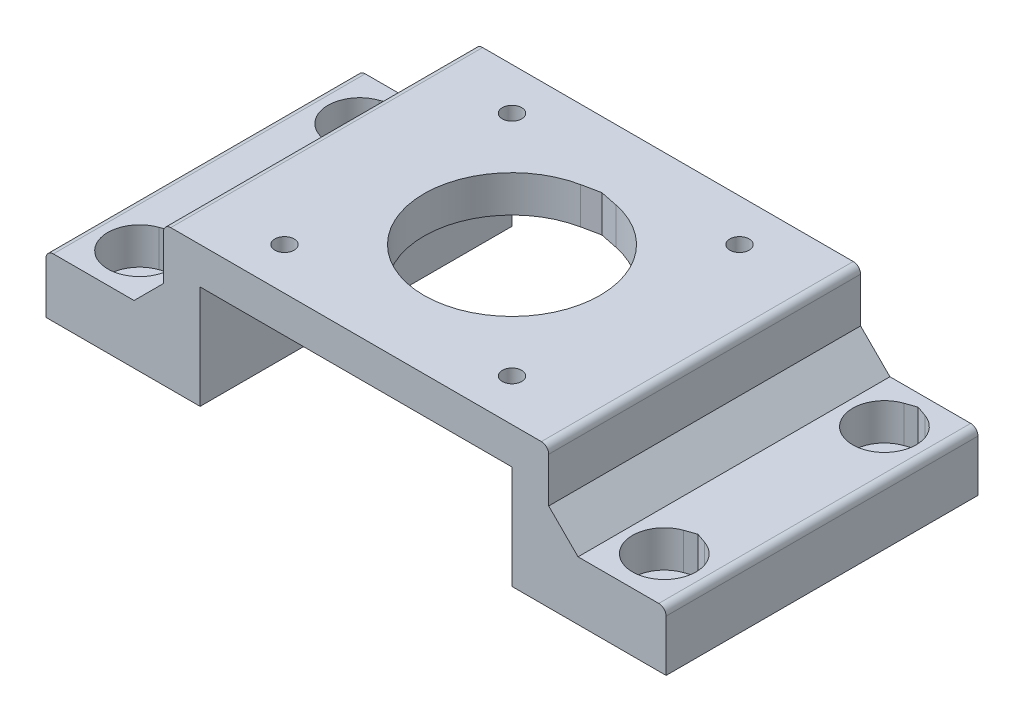
from build123d import *

# Parameters (mm, degrees)
ESQUISSE1_W                  = 42.5
ESQUISSE1_H                  = 42.5
BOSS_EXTRU_1_DEPTH           = 5
ESQUISSE2_R                  = 1.325
ENL_V_MAT_EXTRU_1_DEPTH      = 31.465144017
ENL_V_MAT_EXTRU_2_DEPTH      = 31.465144017
ESQUISSE4_W                  = 42.5
ESQUISSE4_H                  = 19.1
BOSS_EXTRU_2_DEPTH           = 5
ESQUISSE5_W                  = 42.5
ESQUISSE5_H                  = 8
BOSS_EXTRU_3_DEPTH           = 16
ESQUISSE7_R                  = 2.6
ENL_V_MAT_EXTRU_3_DEPTH      = 49.578132941
CONG_2_R                     = 1
CHANFREIN1_SIZE              = 4
CONG_2_OF_SYM_TRIE3_R        = 1
CHANFREIN1_OF_SYM_TRIE3_SIZE = 4
ESQUISSE11_R                 = 4.325
ENL_V_MAT_EXTRU_4_DEPTH      = 5
ENL_V_MAT_EXTRU_5_DEPTH      = 5
ENL_V_MAT_EXTRU_6_DEPTH      = 50.958332638
ENL_V_MAT_EXTRU_7_DEPTH      = 50.958332638
ENL_V_MAT_EXTRU_8_DEPTH      = 5
SYM_TRIE5_COPY_1_SKETCH_R    = 4.325
SYM_TRIE5_COPY_1_DEPTH       = 5


with BuildPart() as part:
    # Esquisse1 → Boss.-Extru.1 (new body)
    with BuildSketch(Plane(origin=(0, 0, 0), x_dir=(1, 0, 0), z_dir=(0, 1, 0))):
        Rectangle(ESQUISSE1_W, ESQUISSE1_H)
    extrude(amount=BOSS_EXTRU_1_DEPTH)

    # Esquisse2 → Enlèv. mat.-Extru.1 (cut, through all)
    with BuildSketch(Plane(origin=(0, 5, 0), x_dir=(1, 0, 0), z_dir=(0, 1, 0))):
        with Locations(Location((-15.5, 15.5, 0), (0, 0, 270))):
            Circle(ESQUISSE2_R)
        with Locations(Location((15.5, 15.5, 0), (0, 0, 270))):
            Circle(ESQUISSE2_R)
    enl_v_mat_extru_1 = extrude(amount=-ENL_V_MAT_EXTRU_1_DEPTH, mode=Mode.SUBTRACT)

    # Symétrie1: Enlèv. mat.-Extru.1 across plane
    add(enl_v_mat_extru_1.mirror(Plane.XY), mode=Mode.SUBTRACT)

    # Esquisse3 → Enlèv. mat.-Extru.2 (cut, through all)
    with BuildSketch(Plane(origin=(0, 5, 0), x_dir=(1, 0, 0), z_dir=(0, 1, 0))):
        with BuildLine():
            Line((2.424108484, 11.752603884), (0, 12.252603884))
            Line((0, 12.252603884), (-2.424108484, 11.752603884))
            ThreePointArc((-2.424108484, 11.752603884), (0, -12), (2.424108484, 11.752603884))
        make_face()
    extrude(amount=-ENL_V_MAT_EXTRU_2_DEPTH, mode=Mode.SUBTRACT)

    # Esquisse4 → Boss.-Extru.2 (add)
    with BuildSketch(Plane(origin=(21.25, 0, 0), x_dir=(0, 0, -1), z_dir=(1, 0, 0))):
        with Locations((0, -4.55)):
            Rectangle(ESQUISSE4_W, ESQUISSE4_H)
    boss_extru_2 = extrude(amount=BOSS_EXTRU_2_DEPTH)

    # Esquisse5 → Boss.-Extru.3 (add)
    with BuildSketch(Plane(origin=(26.25, 0, 0), x_dir=(0, 0, -1), z_dir=(1, 0, 0))):
        with Locations((0, -10.1)):
            Rectangle(ESQUISSE5_W, ESQUISSE5_H)
    boss_extru_3 = extrude(amount=BOSS_EXTRU_3_DEPTH)

    # Esquisse7 → Enlèv. mat.-Extru.3 (cut, through all)
    with BuildSketch(Plane(origin=(0, -6.1, 0), x_dir=(1, 0, 0), z_dir=(0, 1, 0))):
        with Locations(Location((35.75, 15, 0), (0, 0, 270))):
            Circle(ESQUISSE7_R)
        with Locations(Location((35.75, -15, 0), (0, 0, 270))):
            Circle(ESQUISSE7_R)
    enl_v_mat_extru_3 = extrude(amount=-ENL_V_MAT_EXTRU_3_DEPTH, mode=Mode.SUBTRACT)

    # Congé2
    cong_2_edges = [part.edges().sort_by_distance(p)[0] for p in [
        (26.25, 5, 0),
        (42.25, -6.1, 0),
    ]]
    fillet(cong_2_edges, radius=CONG_2_R)

    # Chanfrein1
    chanfrein1_edges = [part.edges().sort_by_distance(p)[0] for p in [
        (26.25, -6.1, 0),
    ]]
    chamfer(chanfrein1_edges, length=CHANFREIN1_SIZE)

    # Symétrie3: Boss.-Extru.2, Boss.-Extru.3, Enlèv. mat.-Extru.3 across plane
    add(boss_extru_2.mirror(Plane(origin=(0, 0, 0), x_dir=(0, 0, 1), z_dir=(1, 0, 0))))
    add(boss_extru_3.mirror(Plane(origin=(0, 0, 0), x_dir=(0, 0, 1), z_dir=(1, 0, 0))))
    add(enl_v_mat_extru_3.mirror(Plane(origin=(0, 0, 0), x_dir=(0, 0, 1), z_dir=(1, 0, 0))), mode=Mode.SUBTRACT)

    # Congé2 of Symétrie3
    cong_2_of_sym_trie3_edges = [part.edges().sort_by_distance(p)[0] for p in [
        (-26.25, 5, 0),
        (-42.25, -6.1, 0),
    ]]
    fillet(cong_2_of_sym_trie3_edges, radius=CONG_2_OF_SYM_TRIE3_R)

    # Chanfrein1 of Symétrie3
    chanfrein1_of_sym_trie3_edges = [part.edges().sort_by_distance(p)[0] for p in [
        (-26.25, -6.1, 0),
    ]]
    chamfer(chanfrein1_of_sym_trie3_edges, length=CHANFREIN1_OF_SYM_TRIE3_SIZE)

    # Esquisse11 → Enlèv. mat.-Extru.4 (cut)
    with BuildSketch(Plane(origin=(0, -6.1, 0), x_dir=(1, 0, 0), z_dir=(0, 1, 0))):
        with Locations(Location((35.75, 15, 0), (0, 0, 270))):
            Circle(ESQUISSE11_R)
    enl_v_mat_extru_4 = extrude(amount=-ENL_V_MAT_EXTRU_4_DEPTH, mode=Mode.SUBTRACT)

    # Symétrie4: Enlèv. mat.-Extru.4 across plane
    add(enl_v_mat_extru_4.mirror(Plane.XY), mode=Mode.SUBTRACT)

    # Esquisse12 → Enlèv. mat.-Extru.5 (cut)
    with BuildSketch(Plane(origin=(0, -6.1, 0), x_dir=(1, 0, 0), z_dir=(0, 1, 0))):
        Polygon((37.178674107, 19.082219408), (34.321325893, 19.082219408), (35.75, 19.582219408), align=None)
    enl_v_mat_extru_5 = extrude(amount=-ENL_V_MAT_EXTRU_5_DEPTH, mode=Mode.SUBTRACT)

    # Esquisse13 → Enlèv. mat.-Extru.6 (cut, through all)
    with BuildSketch(Plane(origin=(0, -11.1, 0), x_dir=(1, 0, 0), z_dir=(0, 1, 0))):
        Polygon((34.663263699, 17.361991577), (36.836736301, 17.361991577), (35.75, 17.861991577), align=None)
    enl_v_mat_extru_6 = extrude(amount=-ENL_V_MAT_EXTRU_6_DEPTH, mode=Mode.SUBTRACT)

    # Esquisse14 → Enlèv. mat.-Extru.7 (cut, through all)
    with BuildSketch(Plane(origin=(0, -11.1, 0), x_dir=(1, 0, 0), z_dir=(0, 1, 0))):
        Polygon((36.836736301, -12.638008423), (35.75, -12.138008423), (34.663263699, -12.638008423), align=None)
    enl_v_mat_extru_7 = extrude(amount=-ENL_V_MAT_EXTRU_7_DEPTH, mode=Mode.SUBTRACT)

    # Esquisse15 → Enlèv. mat.-Extru.8 (cut)
    with BuildSketch(Plane(origin=(0, -6.1, 0), x_dir=(1, 0, 0), z_dir=(0, 1, 0))):
        Polygon((34.321325893, -10.917780592), (37.178674107, -10.917780592), (35.75, -10.417780592), align=None)
    enl_v_mat_extru_8 = extrude(amount=-ENL_V_MAT_EXTRU_8_DEPTH, mode=Mode.SUBTRACT)

    # Symétrie5: Enlèv. mat.-Extru.4, Enlèv. mat.-Extru.5, Enlèv. mat.-Extru.6, Enlèv. mat.-Extru.7, Enlèv. mat.-Extru.8 across plane
    add(enl_v_mat_extru_4.mirror(Plane(origin=(0, 0, 0), x_dir=(0, 0, 1), z_dir=(1, 0, 0))), mode=Mode.SUBTRACT)
    add(enl_v_mat_extru_5.mirror(Plane(origin=(0, 0, 0), x_dir=(0, 0, 1), z_dir=(1, 0, 0))), mode=Mode.SUBTRACT)
    add(enl_v_mat_extru_6.mirror(Plane(origin=(0, 0, 0), x_dir=(0, 0, 1), z_dir=(1, 0, 0))), mode=Mode.SUBTRACT)
    add(enl_v_mat_extru_7.mirror(Plane(origin=(0, 0, 0), x_dir=(0, 0, 1), z_dir=(1, 0, 0))), mode=Mode.SUBTRACT)
    add(enl_v_mat_extru_8.mirror(Plane(origin=(0, 0, 0), x_dir=(0, 0, 1), z_dir=(1, 0, 0))), mode=Mode.SUBTRACT)

    # Symétrie5 copy 1 sketch → Symétrie5 copy 1 (cut)
    with BuildSketch(Plane(origin=(0, -6.1, 0), x_dir=(-1, 0, 0), z_dir=(0, 1, 0))):
        with Locations(Location((35.75, 15, 0), (0, 0, 270))):
            Circle(SYM_TRIE5_COPY_1_SKETCH_R)
    extrude(amount=-SYM_TRIE5_COPY_1_DEPTH, mode=Mode.SUBTRACT)


solid = part.part
